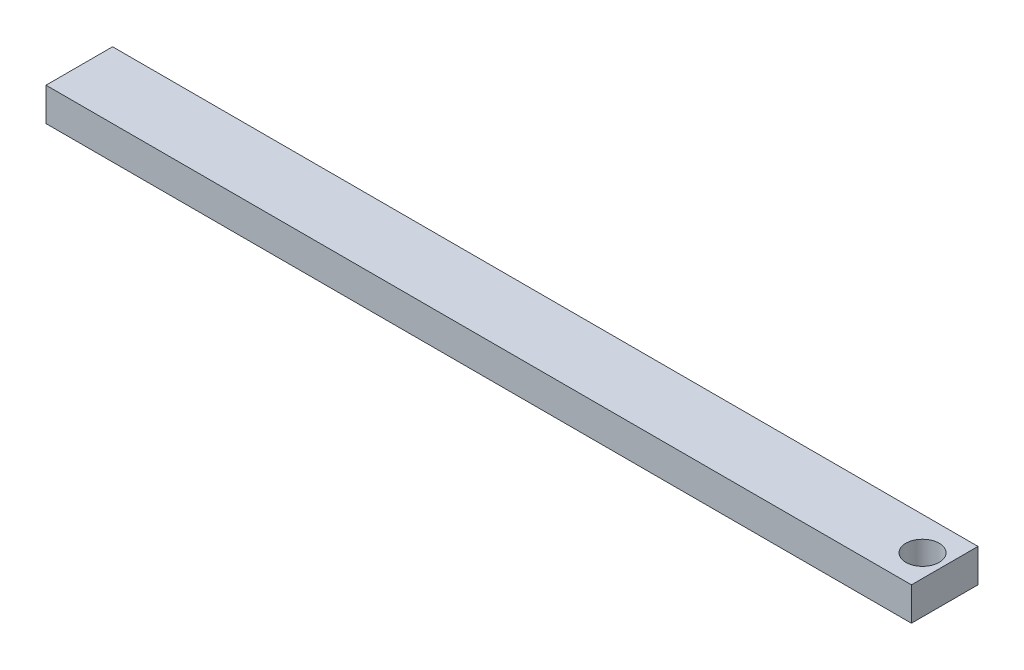
from build123d import *

# Parameters (mm, degrees)
ESQUISSE1_W             = 780
ESQUISSE1_H             = 30
BASE_EXTRUSION_DEPTH    = 30
ESQUISSE3_R             = 15
ENL_V_MAT_EXTRU_1_DEPTH = 702.284535691


with BuildPart() as part:
    # Esquisse1 → Base-Extrusion (new, symmetric)
    with BuildSketch(Plane.XY):
        with Locations((-310, -375)):
            Rectangle(ESQUISSE1_W, ESQUISSE1_H)
    extrude(amount=BASE_EXTRUSION_DEPTH, both=True)

    # Esquisse3 → Enlèv. mat.-Extru.1 (cut, through all)
    with BuildSketch(Plane(origin=(0, -360, 0), x_dir=(-1, 0, 0), z_dir=(0, 1, 0))):
        with Locations(Location((-60, 0, 0), (0, 0, 90))):
            Circle(ESQUISSE3_R)
    extrude(amount=-ENL_V_MAT_EXTRU_1_DEPTH, mode=Mode.SUBTRACT)


solid = part.part
